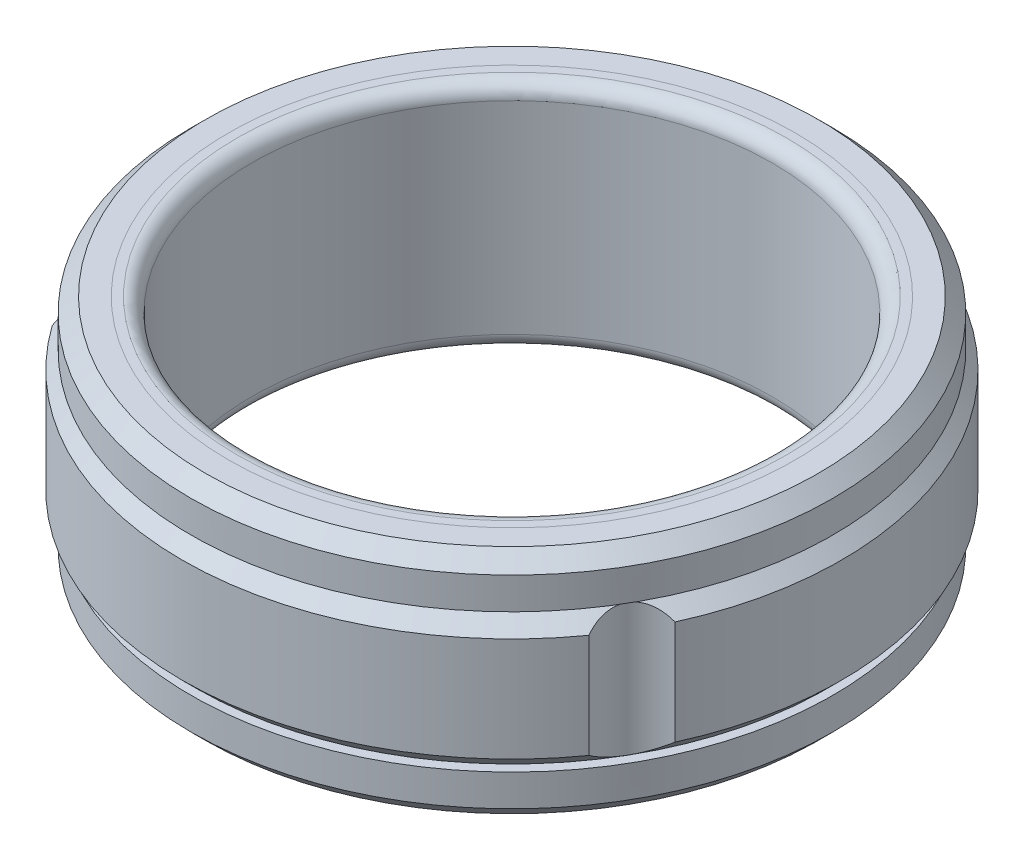
from build123d import *

# Parameters (mm, degrees)
SKETCH1_W          = 1
SKETCH1_H          = 4.6
FILLET1_R          = 0.5
CHAMFER1_SIZE      = 0.5
CHAMFER2_SIZE      = 0.5
CHAMFER3_SIZE      = 0.5
SKETCH2_R          = 1.5875
CUT_EXTRUDE1_DEPTH = 5
CIRPATTERN1_COUNT  = 3


with BuildPart() as part:
    # Sketch1 → Revolve1 (revolve)
    with BuildSketch(Plane.XY, mode=Mode.PRIVATE) as revolve1_sk:
        Polygon((-10.3, -2.4), (-9.8, -2.4), (-9.8, -4), (-9, -4), (-9, 4), (-9.8, 4), (-9.8, 2.4), (-10.3, 2.4), align=None)
        with Locations((-10.9, 0)):
            Rectangle(SKETCH1_W, SKETCH1_H)
    revolve(revolve1_sk.sketch.rotate(Axis((0, 0, 0), (0, 1, 0)), 270), axis=Axis((0, 0, 0), (0, 1, 0)))

    # Fillet1
    fillet1_edges = [part.edges().sort_by_distance(p)[0] for p in [
        (0, -4, 9),
        (0, 4, 9),
    ]]
    fillet(fillet1_edges, radius=FILLET1_R)

    # Chamfer3
    chamfer3_edges = [part.edges().sort_by_distance(p)[0] for p in [
        (0, -2.3, 11.4),
        (0, 2.3, 11.4),
    ]]
    chamfer(chamfer3_edges, length=CHAMFER3_SIZE)

    # Sketch2 → Cut-Extrude1 (cut, symmetric)
    with BuildSketch(Plane(origin=(0, 0, 0), x_dir=(1, 0, 0), z_dir=(0, 1, 0))):
        with Locations((0, 12.5)):
            Circle(SKETCH2_R)
    cut_extrude1 = extrude(amount=CUT_EXTRUDE1_DEPTH, both=True, mode=Mode.SUBTRACT)

    # CirPattern1: Cut-Extrude1 ×3 about axis
    cirpattern1_axis = Axis((0, 0, 0), (0, 1, 0))
    for i in range(1, CIRPATTERN1_COUNT):
        add(cut_extrude1.rotate(cirpattern1_axis, i * 360 / CIRPATTERN1_COUNT), mode=Mode.SUBTRACT)


with BuildPart() as body_2:
    # Sketch1<3> → Revolve2 (revolve)
    with BuildSketch(Plane.XY, mode=Mode.PRIVATE) as revolve2_sk:
        Polygon((-11.1, 4), (-9.8, 4), (-9.8, 2.4), (-10.3, 2.4), (-11.1, 2.4), align=None)
        Polygon((-10.3, -2.4), (-11.1, -2.4), (-11.1, -4), (-9.8, -4), (-9.8, -2.4), align=None)
    revolve(revolve2_sk.sketch.rotate(Axis((0, 0, 0), (0, 1, 0)), 270), axis=Axis((0, 0, 0), (0, 1, 0)))

    # Chamfer1
    chamfer1_edges = [body_2.edges().sort_by_distance(p)[0] for p in [
        (0, 4, 11.1),
    ]]
    chamfer(chamfer1_edges, length=CHAMFER1_SIZE)

    # Chamfer2
    chamfer2_edges = [body_2.edges().sort_by_distance(p)[0] for p in [
        (0, -4, 11.1),
    ]]
    chamfer(chamfer2_edges, length=CHAMFER2_SIZE)


solid = Compound([part.part, body_2.part])
